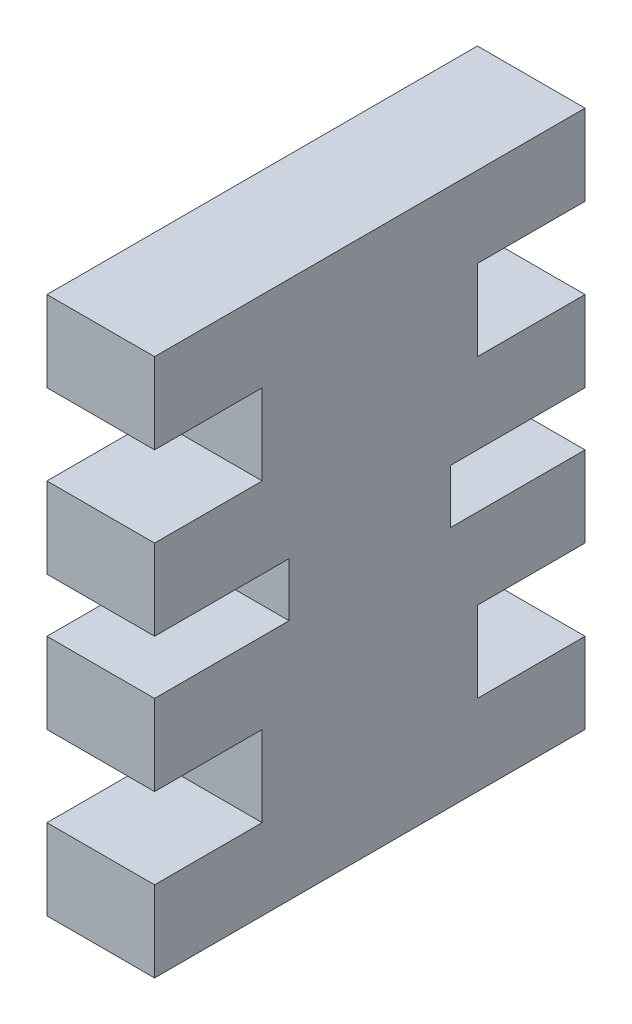
from build123d import *

# Parameters (mm, degrees)
BOSS_EXTRUDE1_DEPTH = 20


with BuildPart() as part:
    # Sketch2 → Boss-Extrude1 (new body)
    with BuildSketch(Plane(origin=(0, 0, 0), x_dir=(0, 0, -1), z_dir=(1, 0, 0))):
        Polygon((0, 0), (80, 0), (80, 15), (60, 15), (60, 30), (80, 30), (80, 45), (55, 45), (55, 55), (80, 55), (80, 70), (60, 70), (60, 85), (80, 85), (80, 100), (0, 100), (0, 85), (20, 85), (20, 70), (0, 70), (0, 55), (25, 55), (25, 45), (0, 45), (0, 30), (20, 30), (20, 15), (0, 15), align=None)
    extrude(amount=-BOSS_EXTRUDE1_DEPTH)


solid = part.part
